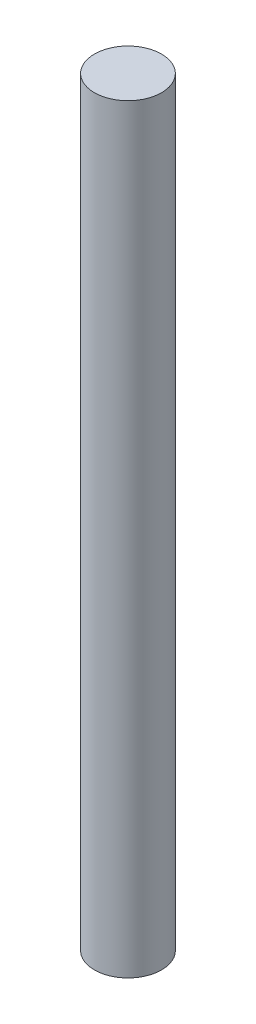
from build123d import *

# Parameters (mm, degrees)
SKETCH1_R           = 1.5
BOSS_EXTRUDE1_DEPTH = 17


with BuildPart() as part:
    # Sketch1 → Boss-Extrude1 (new, symmetric)
    with BuildSketch(Plane(origin=(0, 0, 0), x_dir=(1, 0, 0), z_dir=(0, 1, 0))):
        Circle(SKETCH1_R)
    extrude(amount=BOSS_EXTRUDE1_DEPTH, both=True)


solid = part.part
